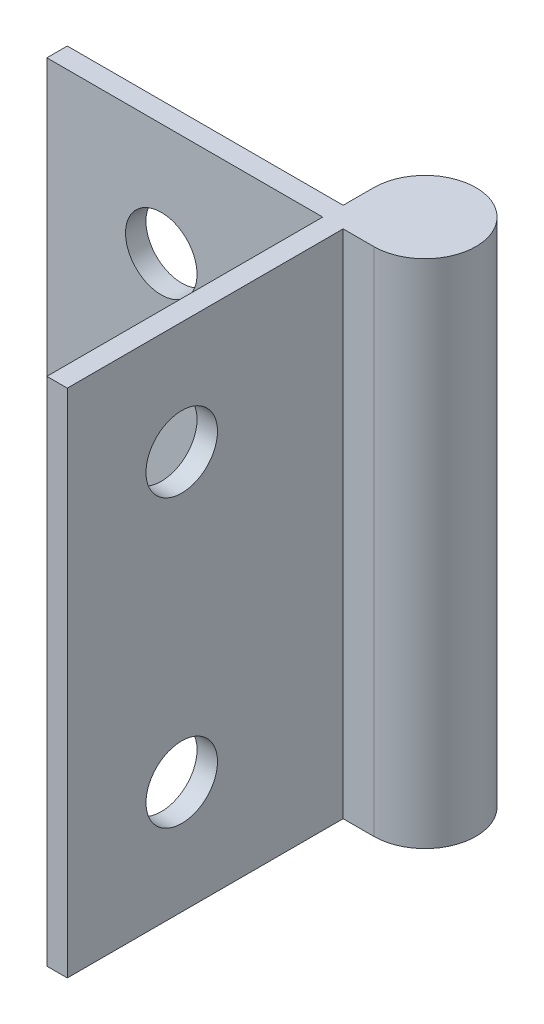
from build123d import *

# Parameters (mm, degrees)
EXTRUDE_1_DEPTH     = 12.5
SKETCH_4_R          = 2.121320344
EXTRUDE_3_DEPTH     = 25
SKETCH_5_R          = 1.75
CUT_EXTRUDE_1_DEPTH = 1
SKETCH_6_R          = 1.75
CUT_EXTRUDE_2_DEPTH = 1


with BuildPart() as part:
    # 草图1 → 凸台-拉伸1 (new, symmetric)
    with BuildSketch(Plane(origin=(0, 0, 0), x_dir=(1, 0, 0), z_dir=(0, 1, 0))):
        with BuildLine():
            ThreePointArc((0, -2.5), (1.767766953, 1.767766953), (-2.5, 0))
            Line((-2.5, 0), (-2.5, -1.5))
            Line((-2.5, -1.5), (-16, -1.5))
            Line((-16, -1.5), (-16, -2.5))
            Line((-16, -2.5), (-2.5, -2.5))
            Line((-2.5, -2.5), (-2.5, -16))
            Line((-2.5, -16), (-1.5, -16))
            Line((-1.5, -16), (-1.5, -2.5))
            Line((-1.5, -2.5), (0, -2.5))
        make_face()
        with BuildLine():
            ThreePointArc((-1.5, 0), (1.060660172, 1.060660172), (0, -1.5))
            Line((0, -1.5), (-1.5, -1.5))
            Line((-1.5, -1.5), (-1.5, 0))
        make_face(mode=Mode.SUBTRACT)
    extrude(amount=EXTRUDE_1_DEPTH, both=True)

    # 草图4 → 凸台-拉伸3 (add)
    with BuildSketch(Plane(origin=(0, 12.5, 0), x_dir=(1, 0, 0), z_dir=(0, 1, 0))):
        Circle(SKETCH_4_R)
    extrude(amount=-EXTRUDE_3_DEPTH)

    # 草图5 → 切除-拉伸1 (cut)
    with BuildSketch(Plane(origin=(0, 0, 1.5), x_dir=(-1, 0, 0), z_dir=(0, 0, -1))):
        with Locations((10.4, -7)):
            Circle(SKETCH_5_R)
        with Locations((10.4, 7)):
            Circle(SKETCH_5_R)
    extrude(amount=-CUT_EXTRUDE_1_DEPTH, mode=Mode.SUBTRACT)

    # 草图6 → 切除-拉伸2 (cut)
    with BuildSketch(Plane(origin=(-1.5, 0, 0), x_dir=(0, 0, -1), z_dir=(1, 0, 0))):
        with Locations((-10.4, -7)):
            Circle(SKETCH_6_R)
        with Locations((-10.4, 7)):
            Circle(SKETCH_6_R)
    extrude(amount=-CUT_EXTRUDE_2_DEPTH, mode=Mode.SUBTRACT)


solid = part.part
